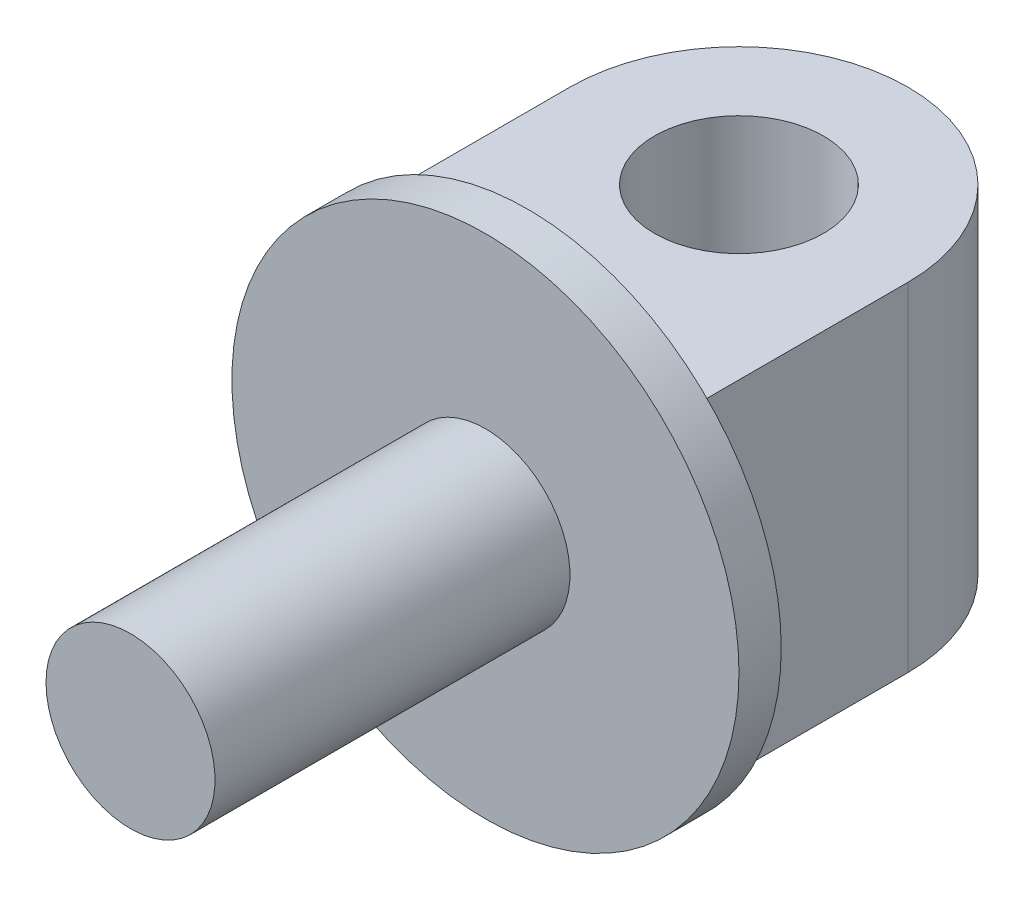
from build123d import *

# Parameters (mm, degrees)
CUFF_STOPPER_SKETCH_R                 = 30
CUFF_STOPPER_EXTRUDE_DEPTH            = 5
CUFF_PIN_SKETCH_R                     = 10
CUFF_PIN_EXTRUDE_DEPTH                = 42
SUPPORT_SKETCH_W                      = 40
SUPPORT_SKETCH_H                      = 40
SUPPORT_EXTRUDE_DEPTH                 = 25
PIN_SUPPORT_EXTRUDE_REACH             = 61.699
PIN_SUPPORT_EXTRUDE_DIRECTION_2_REACH = 61.699
PIN_HOLE_SKETCH_R                     = 10
PIN_HOLE_CUT_DEPTH                    = 40


with BuildPart() as part:
    # Cuff Stopper Sketch → Cuff Stopper Extrude (new body)
    with BuildSketch(Plane.XY):
        Circle(CUFF_STOPPER_SKETCH_R)
    extrude(amount=-CUFF_STOPPER_EXTRUDE_DEPTH)

    # Cuff Pin Sketch → Cuff Pin Extrude (add)
    with BuildSketch(Plane.XY):
        with Locations(Location((0, 0, 0), (0, 0, 180))):
            Circle(CUFF_PIN_SKETCH_R)
    extrude(amount=CUFF_PIN_EXTRUDE_DEPTH)

    # Support Sketch → Support Extrude (add)
    with BuildSketch(Plane(origin=(0, 0, -5), x_dir=(-1, 0, 0), z_dir=(0, 0, -1))):
        Rectangle(SUPPORT_SKETCH_W, SUPPORT_SKETCH_H)
    extrude(amount=SUPPORT_EXTRUDE_DEPTH)

    # Pin Support Extrude: up to this face of the body (flat: up to its plane)
    pin_support_extrude_end = Plane(part.part.faces().sort_by_distance((0, 20, -17.5))[0])
    # Pin Support Sketch → Pin Support Extrude (add, up to the picked face)
    with BuildSketch(Plane(origin=(0, 0, 0), x_dir=(1, 0, 0), z_dir=(0, 1, 0)), mode=Mode.PRIVATE) as pin_support_extrude_sk1:
        with BuildLine():
            Line((20, 30), (-20, 30))
            ThreePointArc((-20, 30), (0, 50), (20, 30))
        make_face()
    pin_support_extrude_tool1 = split(extrude(pin_support_extrude_sk1.sketch, amount=PIN_SUPPORT_EXTRUDE_REACH, mode=Mode.PRIVATE), bisect_by=pin_support_extrude_end, keep=Keep.BOTH, mode=Mode.PRIVATE)
    add(pin_support_extrude_tool1.solids().sort_by(Axis((0, 0, -38.488264), (0, 1, 0)))[0])

    # Pin Support Extrude direction 2: up to this face of the body (flat: up to its plane)
    pin_support_extrude_direction_2_end = Plane(part.part.faces().sort_by_distance((0, -20, -17.5))[0])
    # Pin Support Sketch → Pin Support Extrude direction 2 (add, up to the picked face)
    with BuildSketch(Plane(origin=(0, 0, 0), x_dir=(1, 0, 0), z_dir=(0, 1, 0)), mode=Mode.PRIVATE) as pin_support_extrude_direction_2_sk1:
        with BuildLine():
            Line((20, 30), (-20, 30))
            ThreePointArc((-20, 30), (0, 50), (20, 30))
        make_face()
    pin_support_extrude_direction_2_tool1 = split(extrude(pin_support_extrude_direction_2_sk1.sketch, amount=-PIN_SUPPORT_EXTRUDE_DIRECTION_2_REACH, mode=Mode.PRIVATE), bisect_by=pin_support_extrude_direction_2_end, keep=Keep.BOTH, mode=Mode.PRIVATE)
    add(pin_support_extrude_direction_2_tool1.solids().sort_by(Axis((0, 0, -38.488264), (0, -1, 0)))[0])

    # Pin Hole Sketch → Pin Hole Cut (cut)
    with BuildSketch(Plane(origin=(0, 20, 0), x_dir=(1, 0, 0), z_dir=(0, 1, 0))):
        with Locations(Location((0, 30, 0), (0, 0, 270))):
            Circle(PIN_HOLE_SKETCH_R)
    extrude(amount=-PIN_HOLE_CUT_DEPTH, mode=Mode.SUBTRACT)


solid = part.part
